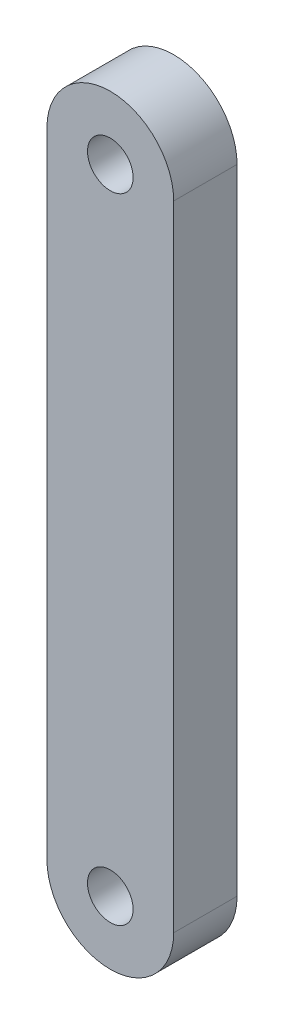
from build123d import *

# Parameters (mm, degrees)
BOSS_EXTRUDE1_DEPTH  = 5
M3_CLEARANCE_HOLE1_D = 3.6


with BuildPart() as part:
    # Sketch1 → Boss-Extrude1 (new body)
    with BuildSketch(Plane.XY):
        with BuildLine():
            Line((5, 25), (5, -25))
            ThreePointArc((5, -25), (0, -30), (-5, -25))
            Line((-5, -25), (-5, 25))
            ThreePointArc((-5, 25), (0, 30), (5, 25))
        make_face()
    extrude(amount=BOSS_EXTRUDE1_DEPTH)

    # M3 Clearance Hole1 (through all)
    with Locations(Plane.XY.offset(5)):
        with Locations((0, 25), (0, -25)):
            Hole(M3_CLEARANCE_HOLE1_D / 2)


solid = part.part
